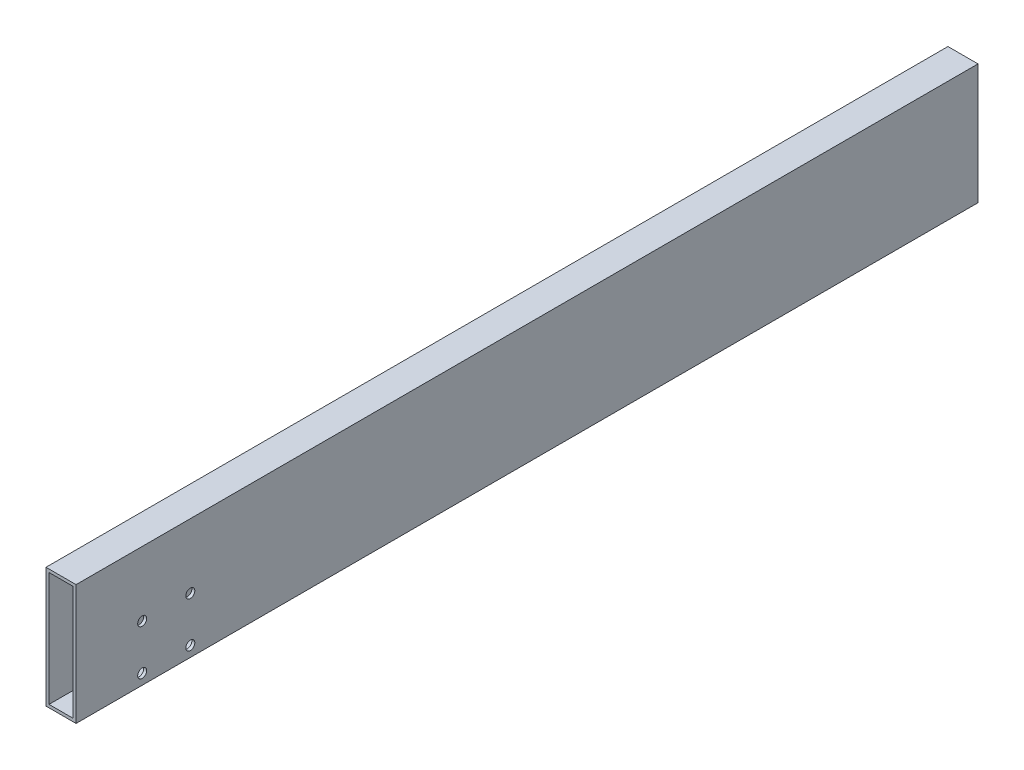
from build123d import *

# Parameters (mm, degrees)
SKETCH_1_W          = 10
SKETCH_1_H          = 40
SKETCH_1_W_2        = 8
SKETCH_1_H_2        = 38
EXTRUDE_1_DEPTH     = 300
SKETCH_3_R          = 1.5
CUT_EXTRUDE_2_DEPTH = 10


with BuildPart() as part:
    # 草图1 → 凸台-拉伸1 (new body)
    with BuildSketch(Plane.XY):
        with Locations((5, 20)):
            Rectangle(SKETCH_1_W, SKETCH_1_H)
        with Locations((5, 20)):
            Rectangle(SKETCH_1_W_2, SKETCH_1_H_2, mode=Mode.SUBTRACT)
    extrude(amount=EXTRUDE_1_DEPTH)

    # 草图3 → 切除-拉伸2 (cut)
    with BuildSketch(Plane(origin=(10, 0, 0), x_dir=(0, 0, -1), z_dir=(1, 0, 0))):
        with Locations((-278, 18.5)):
            Circle(SKETCH_3_R)
        with Locations((-262, 18.5)):
            Circle(SKETCH_3_R)
        with Locations((-262, 3.5)):
            Circle(SKETCH_3_R)
        with Locations((-278, 3.5)):
            Circle(SKETCH_3_R)
    extrude(amount=-CUT_EXTRUDE_2_DEPTH, mode=Mode.SUBTRACT)


solid = part.part
